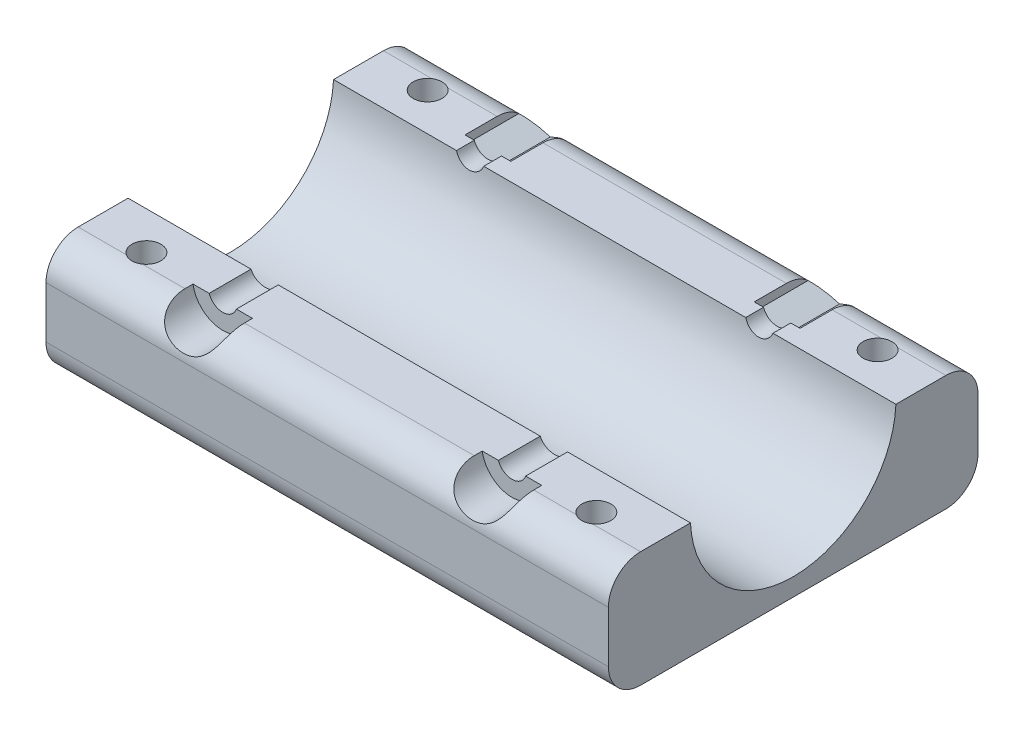
from build123d import *

# Parameters (mm, degrees)
BOSS_EXTRUDE1_DEPTH     = 35
CUT_EXTRUDE1_DEPTH      = 45.485952839
CUT_EXTRUDE1_DEPTH_BACK = 45.485952839
SKETCH2_R               = 12.8
SKETCH3_R               = 1.8
CUT_EXTRUDE2_DEPTH      = 16
SKETCH4_R               = 3.25
CUT_EXTRUDE3_DEPTH      = 5.6
CUT_EXTRUDE4_DEPTH      = 45.485953003
CUT_EXTRUDE4_DEPTH_BACK = 45.485953003
SKETCH5_R               = 1.8
SKETCH6_R               = 3.75
CUT_EXTRUDE5_DEPTH      = 5
CUT_EXTRUDE6_DEPTH      = 8


with BuildPart() as part:
    # Sketch1 → Boss-Extrude1 (new, symmetric)
    with BuildSketch(Plane(origin=(0, 0, 0), x_dir=(0, 0, -1), z_dir=(1, 0, 0))):
        with BuildLine():
            Line((-19, -15), (19, -15))
            ThreePointArc((19, -15), (21.828427125, -13.828427125), (23, -11))
            Line((23, -11), (23, -4.6))
            ThreePointArc((23, -4.6), (21.828427125, -1.771572875), (19, -0.6))
            Line((19, -0.6), (-19, -0.6))
            ThreePointArc((-19, -0.6), (-21.828427125, -1.771572875), (-23, -4.6))
            Line((-23, -4.6), (-23, -11))
            ThreePointArc((-23, -11), (-21.828427125, -13.828427125), (-19, -15))
        make_face()
    extrude(amount=BOSS_EXTRUDE1_DEPTH, both=True)

    # Sketch2 → Cut-Extrude1 (cut, two sides: drawn at the far end of the back side and taken through both)
    with BuildSketch(Plane(origin=(0, 0, 0), x_dir=(0, 0, -1), z_dir=(1, 0, 0)).offset(-CUT_EXTRUDE1_DEPTH_BACK)):
        Circle(SKETCH2_R)
    extrude(amount=CUT_EXTRUDE1_DEPTH + CUT_EXTRUDE1_DEPTH_BACK, mode=Mode.SUBTRACT)

    # Sketch3 → Cut-Extrude2 (cut)
    with BuildSketch(Plane(origin=(0, -15, 0), x_dir=(1, 0, 0), z_dir=(0, 1, 0))):
        with Locations(Location((28, -17.5, 0), (0, 0, 236.442690238))):
            Circle(SKETCH3_R)
        with Locations(Location((28, 17.5, 0), (0, 0, 123.557309762))):
            Circle(SKETCH3_R)
        with Locations(Location((-28, -17.5, 0), (0, 0, 236.442690238))):
            Circle(SKETCH3_R)
        with Locations(Location((-28, 17.5, 0), (0, 0, 123.557309762))):
            Circle(SKETCH3_R)
    extrude(amount=CUT_EXTRUDE2_DEPTH, mode=Mode.SUBTRACT)

    # Sketch4 → Cut-Extrude3 (cut)
    with BuildSketch(Plane(origin=(0, -15, 0), x_dir=(1, 0, 0), z_dir=(0, 1, 0))):
        with Locations(Location((28, -17.5, 0), (0, 0, 207.48642625))):
            Circle(SKETCH4_R)
        with Locations(Location((28, 17.5, 0), (0, 0, 27.48642625))):
            Circle(SKETCH4_R)
        with Locations(Location((-28, -17.5, 0), (0, 0, 207.48642625))):
            Circle(SKETCH4_R)
        with Locations(Location((-28, 17.5, 0), (0, 0, 27.48642625))):
            Circle(SKETCH4_R)
    extrude(amount=CUT_EXTRUDE3_DEPTH, mode=Mode.SUBTRACT)

    # Sketch5 → Cut-Extrude4 (cut, two sides: drawn at the far end of the back side and taken through both)
    with BuildSketch(Plane.XY.offset(-CUT_EXTRUDE4_DEPTH_BACK)):
        with Locations((18, 0)):
            Circle(SKETCH5_R)
        with Locations((-18, 0)):
            Circle(SKETCH5_R)
    extrude(amount=CUT_EXTRUDE4_DEPTH + CUT_EXTRUDE4_DEPTH_BACK, mode=Mode.SUBTRACT)

    # Sketch6 → Cut-Extrude5 (cut)
    with BuildSketch(Plane.XY.offset(23)):
        with Locations((18, 0)):
            Circle(SKETCH6_R)
        with Locations((-18, 0)):
            Circle(SKETCH6_R)
    extrude(amount=-CUT_EXTRUDE5_DEPTH, mode=Mode.SUBTRACT)

    # Sketch7 → Cut-Extrude6 (cut)
    with BuildSketch(Plane.XY.offset(-23)):
        Polygon((20.85, 1.645448267), (18, 3.290896534), (15.15, 1.645448267), (15.15, -1.645448267), (18, -3.290896534), (20.85, -1.645448267), align=None)
        Polygon((-15.15, 1.645448267), (-18, 3.290896534), (-20.85, 1.645448267), (-20.85, -1.645448267), (-18, -3.290896534), (-15.15, -1.645448267), align=None)
    extrude(amount=CUT_EXTRUDE6_DEPTH, mode=Mode.SUBTRACT)


solid = part.part
